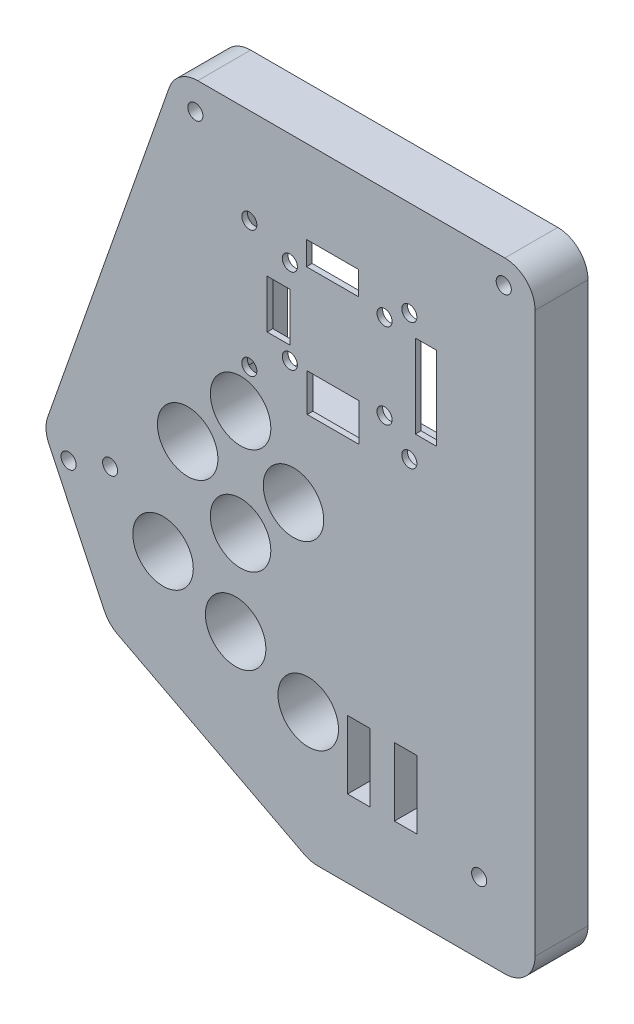
from build123d import *

# Parameters (mm, degrees)
BOSS_EXTRUDE1_DEPTH      = 8.89
CUT_EXTRUDE6_DEPTH       = 112.74556725
CUT_EXTRUDE6_DEPTH_BACK  = 112.74556725
SKETCH9_R                = 1.267511842
SKETCH9_W                = 3.81
SKETCH9_H                = 8.128
SKETCH9_W_2              = 3.556
SKETCH9_H_2              = 13.97
SKETCH9_W_3              = 8.73125
SKETCH9_H_3              = 3.96875
CUT_EXTRUDE7_DEPTH       = 7.9375
CUT_EXTRUDE7_DEPTH_BACK  = 112.74556725
SKETCH4_W                = 34.29
SKETCH4_H                = 30.48
CUT_EXTRUDE8_DEPTH       = 112.74556725
CUT_EXTRUDE8_DEPTH_BACK  = 112.74556725
SKETCH3_R                = 5.08
CUT_EXTRUDE9_DEPTH       = 112.74556725
CUT_EXTRUDE9_DEPTH_BACK  = 112.74556725
SKETCH12_R               = 1.27
CUT_EXTRUDE10_DEPTH      = 112.74556725
CUT_EXTRUDE10_DEPTH_BACK = 112.74556725
SKETCH15_R               = 1.27
CUT_EXTRUDE11_DEPTH      = 112.74556725
CUT_EXTRUDE11_DEPTH_BACK = 112.74556725
SKETCH16_W               = 3.81
SKETCH16_H               = 11.43


with BuildPart() as part:
    # Sketch1 → Boss-Extrude1 (new body)
    with BuildSketch(Plane.XY):
        with BuildLine():
            Line((-3.314058103, 6.35), (48.26, 6.35))
            ThreePointArc((48.26, 6.35), (51.852102448, 4.862102448), (53.34, 1.27))
            Line((53.34, 1.27), (53.34, -92.71))
            ThreePointArc((53.34, -92.71), (51.852102448, -96.302102448), (48.26, -97.79))
            Line((48.26, -97.79), (16.846989059, -97.79))
            ThreePointArc((16.846989059, -97.79), (15.638688158, -97.644208035), (14.499741809, -97.215200367))
            Line((14.499741809, -97.215200367), (-16.7505185, -80.933552139))
            ThreePointArc((-16.7505185, -80.933552139), (-18.059258376, -79.955412607), (-18.989802686, -78.61241436))
            Line((-18.989802686, -78.61241436), (-28.309569459, -59.040904135))
            ThreePointArc((-28.309569459, -59.040904135), (-28.795802898, -57.127870198), (-28.51617555, -55.173917704))
            Line((-28.51617555, -55.173917704), (-8.107195629, 2.952923842))
            ThreePointArc((-8.107195629, 2.952923842), (-6.251501454, 5.414614163), (-3.314058103, 6.35))
        make_face()
    extrude(amount=BOSS_EXTRUDE1_DEPTH)

    # Sketch9 → Cut-Extrude6 (cut, two sides: drawn at the far end of the back side and taken through both)
    with BuildSketch(Plane(origin=(0, 0, 0), x_dir=(-1, 0, 0), z_dir=(0, 0, -1)).offset(-CUT_EXTRUDE6_DEPTH_BACK)):
        with Locations((-5.348417946, -30.953529248)):
            Circle(SKETCH9_R)
        with Locations((-32.218986844, -9.676052932)):
            Circle(SKETCH9_R)
        with Locations((-12.150498686, -12.37729109)):
            Circle(SKETCH9_R)
        with Locations((-12.150498686, -26.66479109)):
            Circle(SKETCH9_R)
        with Locations((-28.057248686, -12.37729109)):
            Circle(SKETCH9_R)
        with Locations((-5.348417946, -9.676052932)):
            Circle(SKETCH9_R)
        with Locations((-32.218986844, -30.953529248)):
            Circle(SKETCH9_R)
        with Locations((-28.057248686, -26.66479109)):
            Circle(SKETCH9_R)
        with Locations((-10.245904396, -20.31479109)):
            Rectangle(SKETCH9_W, SKETCH9_H)
        Polygon((-15.064842187, -33.01479109), (-23.802748686, -33.01479109), (-23.802748686, -26.66479109), (-20.913498686, -26.66479109), (-15.064842187, -26.66479109), align=None)
        with Locations((-35.010498686, -19.798068783)):
            Rectangle(SKETCH9_W_2, SKETCH9_H_2)
        with Locations((-19.310123686, -9.59916609)):
            Rectangle(SKETCH9_W_3, SKETCH9_H_3)
    extrude(amount=CUT_EXTRUDE6_DEPTH + CUT_EXTRUDE6_DEPTH_BACK, mode=Mode.SUBTRACT)

    # Sketch4 → Cut-Extrude7 (cut, two sides: drawn at the far end of the back side and taken through both)
    with BuildSketch(Plane.XY.offset(-CUT_EXTRUDE7_DEPTH_BACK)):
        with Locations((20.024498686, -18.415)):
            Rectangle(SKETCH4_W, SKETCH4_H)
    extrude(amount=CUT_EXTRUDE7_DEPTH + CUT_EXTRUDE7_DEPTH_BACK, mode=Mode.SUBTRACT)

    # Sketch3 → Cut-Extrude8 (cut, two sides: drawn at the far end of the back side and taken through both)
    with BuildSketch(Plane.XY.offset(8.89).offset(-CUT_EXTRUDE8_DEPTH_BACK)):
        with Locations(Location((3.878385852, -38.1, 0), (0, 0, 61.044975628))):
            Circle(SKETCH3_R)
        with Locations((-5.011614148, -46.99)):
            Circle(SKETCH3_R)
        with Locations((3.878385852, -55.88)):
            Circle(SKETCH3_R)
        with Locations((12.768385852, -46.99)):
            Circle(SKETCH3_R)
        with Locations((-9.144, -65.024)):
            Circle(SKETCH3_R)
        with Locations((3.048, -70.612)):
            Circle(SKETCH3_R)
        with Locations((15.24, -76.2)):
            Circle(SKETCH3_R)
    extrude(amount=CUT_EXTRUDE8_DEPTH + CUT_EXTRUDE8_DEPTH_BACK, mode=Mode.SUBTRACT)

    # Sketch12 → Cut-Extrude9 (cut, two sides: drawn at the far end of the back side and taken through both)
    with BuildSketch(Plane(origin=(0, 0, 0), x_dir=(-1, 0, 0), z_dir=(0, 0, -1)).offset(-CUT_EXTRUDE9_DEPTH_BACK)):
        with Locations((-48.0822, 2.286)):
            Circle(SKETCH12_R)
        with Locations((3.718687848, 1.651)):
            Circle(SKETCH12_R)
        with Locations((25.012261453, -59.761967182)):
            Circle(SKETCH12_R)
    extrude(amount=CUT_EXTRUDE9_DEPTH + CUT_EXTRUDE9_DEPTH_BACK, mode=Mode.SUBTRACT)

    # Sketch15 → Cut-Extrude10 (cut, two sides: drawn at the far end of the back side and taken through both)
    with BuildSketch(Plane(origin=(0, 0, 0), x_dir=(-1, 0, 0), z_dir=(0, 0, -1)).offset(-CUT_EXTRUDE10_DEPTH_BACK)):
        with Locations((18.034, -57.15)):
            Circle(SKETCH15_R)
        with Locations((-43.942, -85.852)):
            Circle(SKETCH15_R)
    extrude(amount=CUT_EXTRUDE10_DEPTH + CUT_EXTRUDE10_DEPTH_BACK, mode=Mode.SUBTRACT)

    # Sketch16 → Cut-Extrude11 (cut, two sides: drawn at the far end of the back side and taken through both)
    with BuildSketch(Plane(origin=(0, 0, 0), x_dir=(-1, 0, 0), z_dir=(0, 0, -1)).offset(-CUT_EXTRUDE11_DEPTH_BACK)):
        with Locations((-23.749, -79.121)):
            Rectangle(SKETCH16_W, SKETCH16_H)
        with Locations((-31.623, -79.121)):
            Rectangle(SKETCH16_W, SKETCH16_H)
    extrude(amount=CUT_EXTRUDE11_DEPTH + CUT_EXTRUDE11_DEPTH_BACK, mode=Mode.SUBTRACT)


solid = part.part
